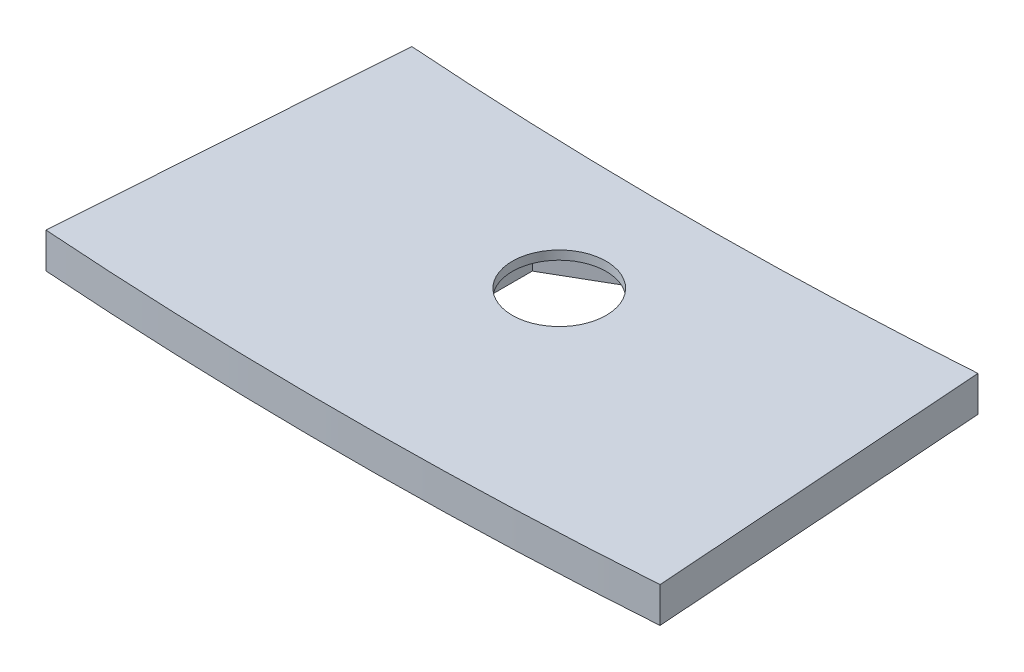
from build123d import *

# Parameters (mm, degrees)
SKETCH2_R           = 2.65
BOSS_EXTRUDE1_DEPTH = 2
CUT_EXTRUDE1_DEPTH  = 1.5


with BuildPart() as part:
    # Sketch2 → Boss-Extrude1 (new body)
    with BuildSketch(Plane(origin=(0, 0, 0), x_dir=(1, 0, 0), z_dir=(0, 1, 0))):
        with BuildLine():
            Line((-15.984695958, -228.591802117), (-17.334483725, -247.89466649))
            ThreePointArc((-17.334483725, -247.89466649), (0, -248.5), (17.334483725, -247.89466649))
            Line((17.334483725, -247.89466649), (15.984695958, -228.591802117))
            ThreePointArc((15.984695958, -228.591802117), (0, -229.15), (-15.984695958, -228.591802117))
        make_face()
        with Locations(Location((0, -236.25, 0), (0, 0, 270))):
            Circle(SKETCH2_R, mode=Mode.SUBTRACT)
    extrude(amount=BOSS_EXTRUDE1_DEPTH)

    # Sketch3 → Cut-Extrude1 (cut)
    with BuildSketch(Plane(origin=(0, 0, 0), x_dir=(1, 0, 0), z_dir=(0, 1, 0))):
        Polygon((0, -240.406921938), (3.6, -238.328460969), (3.6, -234.171539031), (0, -232.093078062), (-3.6, -234.171539031), (-3.6, -238.328460969), align=None)
    extrude(amount=CUT_EXTRUDE1_DEPTH, mode=Mode.SUBTRACT)


solid = part.part
